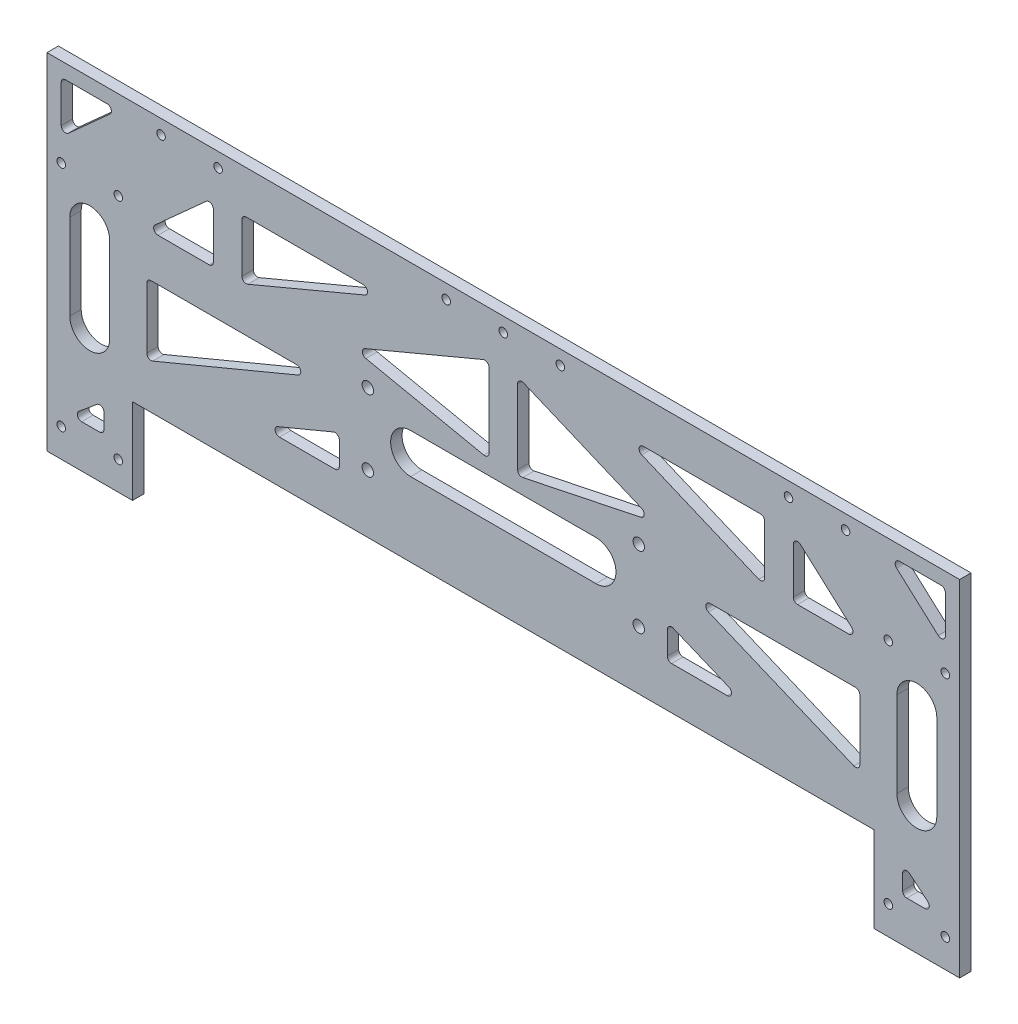
from build123d import *

# Parameters (mm, degrees)
SKETCH_1_W          = 320
SKETCH_1_H          = 121
EXTRUDE_1_DEPTH     = 4
SKETCH_2_W          = 5
SKETCH_2_H          = 30
CUT_EXTRUDE_1_DEPTH = 343.135937896
SKETCH_3_R          = 1.5
CUT_EXTRUDE_2_DEPTH = 343.135937896
SKETCH_4_R          = 1.5
CUT_EXTRUDE_3_DEPTH = 343.135937896
SKETCH_6_R          = 2
CUT_EXTRUDE_5_DEPTH = 343.135937896
SKETCH_5_W          = 250
SKETCH_5_H          = 30
CUT_EXTRUDE_4_DEPTH = 343.135937896


with BuildPart() as part:
    # 草图1 → 凸台-拉伸1 (new body)
    with BuildSketch(Plane.XY):
        with Locations((160, 60.5)):
            Rectangle(SKETCH_1_W, SKETCH_1_H)
    extrude(amount=EXTRUDE_1_DEPTH)

    # 草图2 → 切除-拉伸1 (cut, through all)
    with BuildSketch(Plane.XY.offset(4)):
        with Locations((32.5, 15)):
            Rectangle(SKETCH_2_W, SKETCH_2_H)
        with Locations((287.5, 15)):
            Rectangle(SKETCH_2_W, SKETCH_2_H)
    extrude(amount=-CUT_EXTRUDE_1_DEPTH, mode=Mode.SUBTRACT)

    # 草图3 → 切除-拉伸2 (cut, through all)
    with BuildSketch(Plane.XY.offset(4)):
        with Locations((40, 116)):
            Circle(SKETCH_3_R)
        with Locations((60, 116)):
            Circle(SKETCH_3_R)
        with Locations((140, 116)):
            Circle(SKETCH_3_R)
        with Locations((160, 116)):
            Circle(SKETCH_3_R)
        with Locations(Location((260, 116, 0), (0, 0, 180))):
            Circle(SKETCH_3_R)
        with Locations(Location((280, 116, 0), (0, 0, 180))):
            Circle(SKETCH_3_R)
        with Locations(Location((180, 116, 0), (0, 0, 180))):
            Circle(SKETCH_3_R)
    extrude(amount=-CUT_EXTRUDE_2_DEPTH, mode=Mode.SUBTRACT)

    # 草图4 → 切除-拉伸3 (cut, through all)
    with BuildSketch(Plane.XY.offset(4)):
        with Locations((5, 90)):
            Circle(SKETCH_4_R)
        with Locations((25, 90)):
            Circle(SKETCH_4_R)
        with Locations((5, 10)):
            Circle(SKETCH_4_R)
        with Locations((25, 10)):
            Circle(SKETCH_4_R)
        with Locations(Location((295, 10, 0), (0, 0, 180))):
            Circle(SKETCH_4_R)
        with Locations(Location((315, 10, 0), (0, 0, 180))):
            Circle(SKETCH_4_R)
        with Locations(Location((295, 90, 0), (0, 0, 180))):
            Circle(SKETCH_4_R)
        with Locations(Location((315, 90, 0), (0, 0, 180))):
            Circle(SKETCH_4_R)
    extrude(amount=-CUT_EXTRUDE_3_DEPTH, mode=Mode.SUBTRACT)

    # 草图6 → 切除-拉伸5 (cut, through all)
    with BuildSketch(Plane.XY.offset(4)):
        with Locations((112.5, 75.5)):
            Circle(SKETCH_6_R)
        with Locations((207.5, 75.5)):
            Circle(SKETCH_6_R)
        with Locations((207.5, 50.5)):
            Circle(SKETCH_6_R)
        with Locations((112.5, 50.5)):
            Circle(SKETCH_6_R)
        with BuildLine():
            Line((127.5, 70), (192.5, 70))
            ThreePointArc((192.5, 70), (199.5, 63), (192.5, 56))
            Line((192.5, 56), (127.5, 56))
            ThreePointArc((127.5, 56), (120.5, 63), (127.5, 70))
        make_face()
    extrude(amount=-CUT_EXTRUDE_5_DEPTH, mode=Mode.SUBTRACT)

    # 草图5 → 切除-拉伸4 (cut, through all)
    with BuildSketch(Plane.XY.offset(4)):
        with BuildLine():
            Line((5, 101.368043607), (5, 114.5))
            ThreePointArc((5, 114.5), (5.439339828, 115.560660172), (6.5, 116))
            Line((6.5, 116), (21.091062659, 116))
            ThreePointArc((21.091062659, 116), (22.491493276, 115.037395651), (22.094509756, 113.385058781))
            Line((22.094509756, 113.385058781), (7.503447097, 100.253102388))
            ThreePointArc((7.503447097, 100.253102388), (5.889742123, 99.997793512), (5, 101.368043607))
        make_face()
        with BuildLine():
            Line((22, 75), (22, 45))
            ThreePointArc((22, 45), (15, 38), (8, 45))
            Line((8, 45), (8, 75))
            ThreePointArc((8, 75), (15, 82), (22, 75))
        make_face()
        with BuildLine():
            Line((38.908937341, 85), (56.833333333, 85))
            ThreePointArc((56.833333333, 85), (57.893993505, 85.439339828), (58.333333333, 86.5))
            Line((58.333333333, 86.5), (58.333333333, 102.631956393))
            ThreePointArc((58.333333333, 102.631956393), (57.443591211, 104.002206488), (55.829886236, 103.746897612))
            Line((55.829886236, 103.746897612), (37.905490244, 87.614941219))
            ThreePointArc((37.905490244, 87.614941219), (37.508506724, 85.962604349), (38.908937341, 85))
        make_face()
        with BuildLine():
            Line((35, 68.5), (35, 47.25))
            ThreePointArc((35, 47.25), (35.667949706, 46.001924558), (37.076923077, 45.865384615))
            Line((37.076923077, 45.865384615), (88.076923077, 67.115384615))
            ThreePointArc((88.076923077, 67.115384615), (88.970871014, 68.794174203), (87.5, 70))
            Line((87.5, 70), (36.5, 70))
            ThreePointArc((36.5, 70), (35.439339828, 69.560660172), (35, 68.5))
        make_face()
        with Locations((160, 15)):
            Rectangle(SKETCH_5_W, SKETCH_5_H)
        with BuildLine():
            Line((81.5, 45), (101, 45))
            ThreePointArc((101, 45), (102.060660172, 45.439339828), (102.5, 46.5))
            Line((102.5, 46.5), (102.5, 54.625))
            ThreePointArc((102.5, 54.625), (101.832050294, 55.873075442), (100.423076923, 56.009615385))
            Line((100.423076923, 56.009615385), (80.923076923, 47.884615385))
            ThreePointArc((80.923076923, 47.884615385), (80.029128986, 46.205825797), (81.5, 45))
        make_face()
        with BuildLine():
            Line((68.333333333, 87.256929624), (68.333333333, 104.5))
            ThreePointArc((68.333333333, 104.5), (68.772673162, 105.560660172), (69.833333333, 106))
            Line((69.833333333, 106), (110.888262801, 106))
            ThreePointArc((110.888262801, 106), (112.358715068, 104.796260242), (111.469111528, 103.117026842))
            Line((111.469111528, 103.117026842), (70.41418206, 85.873956465))
            ThreePointArc((70.41418206, 85.873956465), (69.00305419, 86.007675228), (68.333333333, 87.256929624))
        make_face()
        with BuildLine():
            Line((111.788920254, 84.01540935), (153.193641955, 75.376872258))
            ThreePointArc((153.193641955, 75.376872258), (154.446166722, 75.68130869), (155, 76.845253935))
            Line((155, 76.845253935), (155, 102.873774141))
            ThreePointArc((155, 102.873774141), (154.330279143, 104.123028536), (152.919151273, 104.256747299))
            Line((152.919151273, 104.256747299), (111.514429572, 86.866764185))
            ThreePointArc((111.514429572, 86.866764185), (110.602180826, 85.340055375), (111.788920254, 84.01540935))
        make_face()
        with BuildLine():
            Line((167.080848727, 104.256747299), (208.485570428, 86.866764185))
            ThreePointArc((208.485570428, 86.866764185), (209.397819174, 85.340055375), (208.211079746, 84.01540935))
            Line((208.211079746, 84.01540935), (166.806358045, 75.376872258))
            ThreePointArc((166.806358045, 75.376872258), (165.553833278, 75.68130869), (165, 76.845253935))
            Line((165, 76.845253935), (165, 102.873774141))
            ThreePointArc((165, 102.873774141), (165.669720857, 104.123028536), (167.080848727, 104.256747299))
        make_face()
        with BuildLine():
            Line((208.530888472, 103.117026842), (249.58581794, 85.873956465))
            ThreePointArc((249.58581794, 85.873956465), (250.99694581, 86.007675228), (251.666666667, 87.256929624))
            Line((251.666666667, 87.256929624), (251.666666667, 104.5))
            ThreePointArc((251.666666667, 104.5), (251.227326838, 105.560660172), (250.166666667, 106))
            Line((250.166666667, 106), (209.111737199, 106))
            ThreePointArc((209.111737199, 106), (207.641284932, 104.796260242), (208.530888472, 103.117026842))
        make_face()
        with BuildLine():
            Line((219.576923077, 56.009615385), (239.076923077, 47.884615385))
            ThreePointArc((239.076923077, 47.884615385), (239.970871014, 46.205825797), (238.5, 45))
            Line((238.5, 45), (219, 45))
            ThreePointArc((219, 45), (217.939339828, 45.439339828), (217.5, 46.5))
            Line((217.5, 46.5), (217.5, 54.625))
            ThreePointArc((217.5, 54.625), (218.167949706, 55.873075442), (219.576923077, 56.009615385))
        make_face()
        with BuildLine():
            Line((232.5, 70), (283.5, 70))
            ThreePointArc((283.5, 70), (284.560660172, 69.560660172), (285, 68.5))
            Line((285, 68.5), (285, 47.25))
            ThreePointArc((285, 47.25), (284.332050294, 46.001924558), (282.923076923, 45.865384615))
            Line((282.923076923, 45.865384615), (231.923076923, 67.115384615))
            ThreePointArc((231.923076923, 67.115384615), (231.029128986, 68.794174203), (232.5, 70))
        make_face()
        with BuildLine():
            Line((264.170113764, 103.746897612), (282.094509756, 87.614941219))
            ThreePointArc((282.094509756, 87.614941219), (282.491493276, 85.962604349), (281.091062659, 85))
            Line((281.091062659, 85), (263.166666667, 85))
            ThreePointArc((263.166666667, 85), (262.106006495, 85.439339828), (261.666666667, 86.5))
            Line((261.666666667, 86.5), (261.666666667, 102.631956393))
            ThreePointArc((261.666666667, 102.631956393), (262.556408789, 104.002206488), (264.170113764, 103.746897612))
        make_face()
        with BuildLine():
            Line((297.905490244, 113.385058781), (312.496552903, 100.253102388))
            ThreePointArc((312.496552903, 100.253102388), (314.110257877, 99.997793512), (315, 101.368043607))
            Line((315, 101.368043607), (315, 114.5))
            ThreePointArc((315, 114.5), (314.560660172, 115.560660172), (313.5, 116))
            Line((313.5, 116), (298.908937341, 116))
            ThreePointArc((298.908937341, 116), (297.508506724, 115.037395651), (297.905490244, 113.385058781))
        make_face()
        with BuildLine():
            Line((298, 75), (298, 45))
            ThreePointArc((298, 45), (305, 38), (312, 45))
            Line((312, 45), (312, 75))
            ThreePointArc((312, 75), (305, 82), (298, 75))
        make_face()
        with BuildLine():
            Line((12.143074903, 15), (18.5, 15))
            ThreePointArc((18.5, 15), (19.560660172, 15.439339828), (20, 16.5))
            Line((20, 16.5), (20, 21.797437581))
            ThreePointArc((20, 21.797437581), (19.136233094, 23.155821713), (17.539723401, 22.9497695))
            Line((17.539723401, 22.9497695), (11.182798303, 17.652331919))
            ThreePointArc((11.182798303, 17.652331919), (10.732667536, 15.989362104), (12.143074903, 15))
        make_face()
        with BuildLine():
            Line((302.460276599, 22.9497695), (308.817201697, 17.652331919))
            ThreePointArc((308.817201697, 17.652331919), (309.267332464, 15.989362104), (307.856925097, 15))
            Line((307.856925097, 15), (301.5, 15))
            ThreePointArc((301.5, 15), (300.439339828, 15.439339828), (300, 16.5))
            Line((300, 16.5), (300, 21.797437581))
            ThreePointArc((300, 21.797437581), (300.863766906, 23.155821713), (302.460276599, 22.9497695))
        make_face()
    extrude(amount=-CUT_EXTRUDE_4_DEPTH, mode=Mode.SUBTRACT)


solid = part.part
